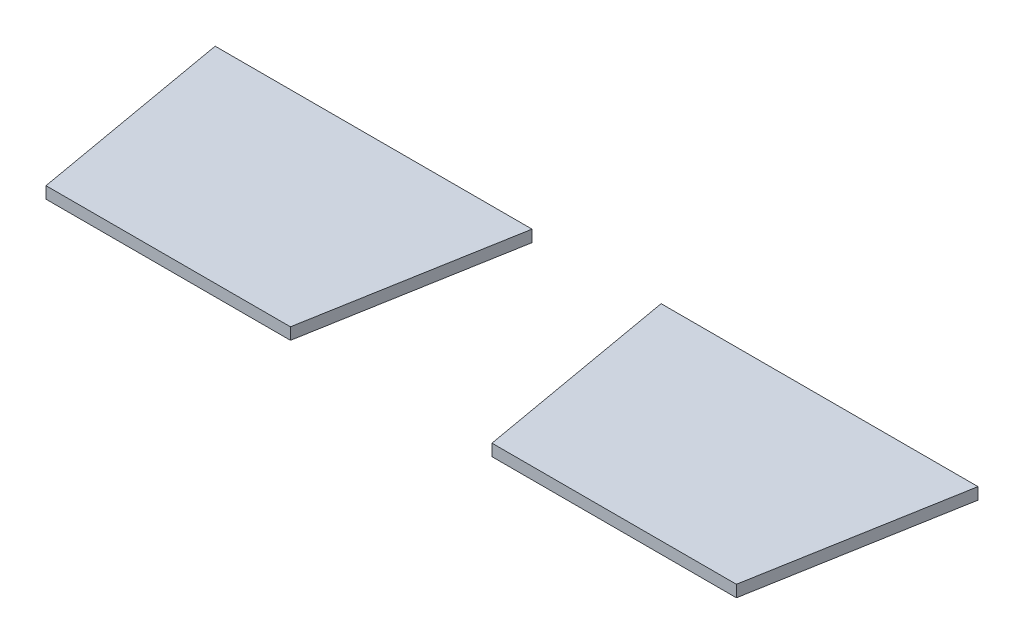
from build123d import *

# Parameters (mm, degrees)
EXTRUDE_1_DEPTH   = 2
EXTRUDE_1_2_DEPTH = 2


with BuildPart() as part:
    # 草图1 → 凸台-拉伸1 (new body)
    with BuildSketch(Plane(origin=(0, 0, 0), x_dir=(1, 0, 0), z_dir=(0, 1, 0))):
        Polygon((-65, 17.5), (-58.828555675, -17.5), (-17.171444325, -17.5), (-11, 17.5), align=None)
    extrude(amount=EXTRUDE_1_DEPTH)


with BuildPart() as body_2:
    # 草图1 → Extrude 1 2 (new body)
    with BuildSketch(Plane(origin=(0, 0, 0), x_dir=(1, 0, 0), z_dir=(0, 1, 0))):
        Polygon((58.828555675, -17.5), (17.171444325, -17.5), (11, 17.5), (65, 17.5), align=None)
    extrude(amount=EXTRUDE_1_2_DEPTH)


solid = Compound([part.part, body_2.part])
